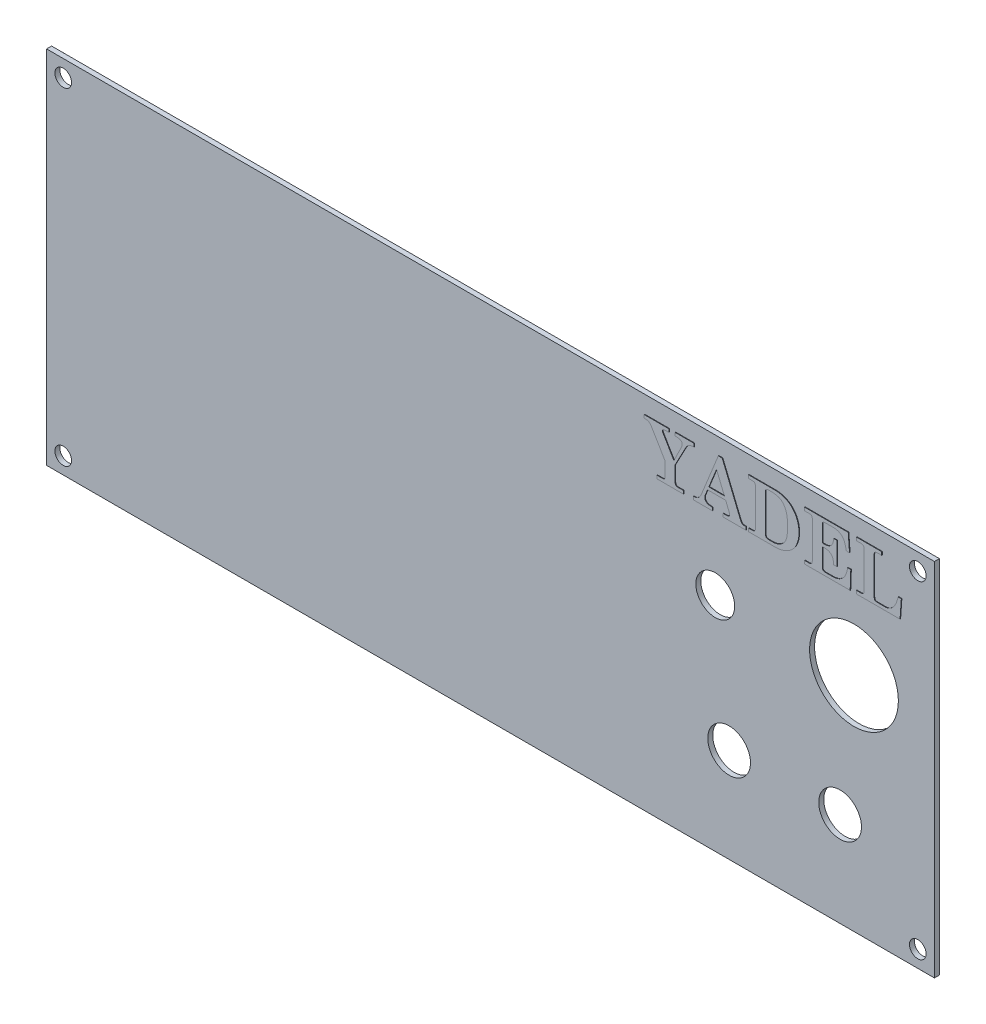
from build123d import *

# Parameters (mm, degrees)
ESQUISSE1_W             = 160
ESQUISSE1_H             = 65
ESQUISSE1_R             = 1.5
BOSS_EXTRU_1_DEPTH      = 0.9
ESQUISSE2_R             = 3.85
ESQUISSE2_R_2           = 3.5
ESQUISSE2_R_3           = 8
ENL_V_MAT_EXTRU_1_DEPTH = 0.9
BOSS_EXTRU_2_DEPTH      = 0.1


with BuildPart() as part:
    # Esquisse1 → Boss.-Extru.1 (new body)
    with BuildSketch(Plane.XY):
        with Locations((80, 32.5)):
            Rectangle(ESQUISSE1_W, ESQUISSE1_H)
        with Locations((3, 62)):
            Circle(ESQUISSE1_R, mode=Mode.SUBTRACT)
        with Locations((3, 3)):
            Circle(ESQUISSE1_R, mode=Mode.SUBTRACT)
        with Locations((157, 3)):
            Circle(ESQUISSE1_R, mode=Mode.SUBTRACT)
        with Locations((157, 62)):
            Circle(ESQUISSE1_R, mode=Mode.SUBTRACT)
    extrude(amount=BOSS_EXTRU_1_DEPTH)

    # Esquisse2 → Enlèv. mat.-Extru.1 (cut)
    with BuildSketch(Plane.XY.offset(0.9)):
        with Locations((123, 17)):
            Circle(ESQUISSE2_R)
        with Locations((143, 17)):
            Circle(ESQUISSE2_R)
        with Locations((120.5, 40)):
            Circle(ESQUISSE2_R_2)
        with Locations((145.5, 40)):
            Circle(ESQUISSE2_R_3)
    extrude(amount=-ENL_V_MAT_EXTRU_1_DEPTH, mode=Mode.SUBTRACT)

    # Esquisse3 → Boss.-Extru.2 (add)
    # profile 1 of 5: a face of its own
    with BuildSketch(Plane.XY.offset(0.9)):
        with BuildLine():
            Line((107.803249783, 61.878700087), (112.242599826, 61.878700087))
            Line((112.242599826, 61.878700087), (112.242599826, 61.309552645))
            Line((112.242599826, 61.309552645), (111.65033077, 61.309552645))
            add(Edge.make_bspline(
                [(111.65033077, 61.309552645), (111.601702611, 61.308454076), (111.512497697, 61.306438828), (111.389695329, 61.294195269), (111.290815636, 61.267793), (111.213442358, 61.233011403), (111.157163614, 61.187912023), (111.116336773, 61.137443039), (111.091860734, 61.078577306), (111.089493142, 61.037052927), (111.088297672, 61.016085996)],
                knots=[0, 0, 0, 0, 1.649978988, 3.026769637, 4.173115814, 5.108527378, 5.881060813, 6.597094959, 7.291630266, 8, 8, 8, 8], degree=3))
            add(Edge.make_bspline(
                [(111.088297672, 61.016085996), (111.089977515, 60.990502541), (111.093534977, 60.936323583), (111.113788996, 60.852925912), (111.148752249, 60.764295708), (111.180131697, 60.705704348), (111.196791403, 60.674597531)],
                knots=[0, 0, 0, 0, 0.848893184, 1.797730134, 2.830789942, 4, 4, 4, 4], degree=3))
            Line((111.196791403, 60.674597531), (113.151457147, 57.384213885))
            Line((113.151457147, 57.384213885), (114.467610605, 60.062764031))
            add(Edge.make_bspline(
                [(114.467610605, 60.062764031), (114.492308376, 60.116308185), (114.539555902, 60.21873965), (114.592060605, 60.37270507), (114.624057984, 60.519726034), (114.628901276, 60.615763261), (114.631240495, 60.662147431)],
                knots=[0, 0, 0, 0, 1.129148263, 2.160092213, 3.111359234, 4, 4, 4, 4], degree=3))
            add(Edge.make_bspline(
                [(114.631240495, 60.662147431), (114.628890225, 60.709960902), (114.624339537, 60.802539302), (114.577744453, 60.933247792), (114.500488055, 61.046231285), (114.394335627, 61.141897185), (114.259129041, 61.219788045), (114.093304867, 61.273166228), (113.897871595, 61.30454599), (113.758086441, 61.307806939), (113.683254288, 61.309552645)],
                knots=[0, 0, 0, 0, 0.884200254, 1.7120247, 2.535601234, 3.399669589, 4.34091696, 5.408595814, 6.612725681, 8, 8, 8, 8], degree=3))
            Line((113.683254288, 61.309552645), (113.380894709, 61.309552645))
            Line((113.380894709, 61.309552645), (113.380894709, 61.878700087))
            Line((113.380894709, 61.878700087), (116.795779358, 61.878700087))
            Line((116.795779358, 61.878700087), (116.795779358, 61.309552645))
            add(Edge.make_bspline(
                [(116.795779358, 61.309552645), (116.701864753, 61.305341496), (116.522933112, 61.297318167), (116.269410451, 61.249598245), (116.04271407, 61.181142313), (115.843132279, 61.078738008), (115.667196786, 60.944949669), (115.50647049, 60.77975143), (115.361006002, 60.579660238), (115.279838525, 60.429026345), (115.237738237, 60.350894924)],
                knots=[0, 0, 0, 0, 1.158631572, 2.207493144, 3.17456629, 4.071024185, 4.959115416, 5.890271789, 6.905717302, 8, 8, 8, 8], degree=3))
            Line((115.237738237, 60.350894924), (113.380894709, 56.838188058))
            Line((113.380894709, 56.838188058), (113.380894709, 54.054701352))
            add(Edge.make_bspline(
                [(113.380894709, 54.054701352), (113.382450672, 54.016000693), (113.385361202, 53.943608619), (113.410841916, 53.841847127), (113.452890241, 53.755385318), (113.513981536, 53.684544285), (113.594580242, 53.631287025), (113.69389748, 53.595560179), (113.8113998, 53.571852385), (113.895956035, 53.570089604), (113.941149222, 53.569147441)],
                knots=[0, 0, 0, 0, 1.088641102, 2.036373277, 2.932535239, 3.772977452, 4.639074189, 5.622189685, 6.729120018, 8, 8, 8, 8], degree=3))
            Line((113.941149222, 53.569147441), (114.860678057, 53.569147441))
            Line((114.860678057, 53.569147441), (114.860678057, 53))
            Line((114.860678057, 53), (110.079839549, 53))
            Line((110.079839549, 53), (110.079839549, 53.569147441))
            Line((110.079839549, 53.569147441), (110.994032627, 53.569147441))
            add(Edge.make_bspline(
                [(110.994032627, 53.569147441), (111.042106523, 53.570407346), (111.131696362, 53.572755286), (111.255430941, 53.592110108), (111.35552508, 53.62969708), (111.436075692, 53.68037011), (111.492597003, 53.752026332), (111.531736013, 53.838730773), (111.557208899, 53.94122924), (111.558786931, 54.015406048), (111.559622897, 54.054701352)],
                knots=[0, 0, 0, 0, 1.33431287, 2.486606761, 3.455237023, 4.285744345, 5.09261012, 5.946421484, 6.912112891, 8, 8, 8, 8], degree=3))
            Line((111.559622897, 54.054701352), (111.559622897, 56.528714137))
            Line((111.559622897, 56.528714137), (109.124738999, 60.626575716))
            add(Edge.make_bspline(
                [(109.124738999, 60.626575716), (109.087572878, 60.687978254), (109.016957941, 60.804641934), (108.895744566, 60.955835012), (108.773093192, 61.078123095), (108.642460107, 61.169434934), (108.500782074, 61.231277161), (108.347833512, 61.279040524), (108.177611233, 61.304739401), (108.058850731, 61.307906366), (107.99711563, 61.309552645)],
                knots=[0, 0, 0, 0, 1.231026377, 2.338927208, 3.317810476, 4.195831411, 5.056695332, 5.961387997, 6.940271265, 8, 8, 8, 8], degree=3))
            Line((107.99711563, 61.309552645), (107.803249783, 61.309552645))
            Line((107.803249783, 61.309552645), (107.803249783, 61.878700087))
        make_face()
    # profile 2 of 5: a face of its own
    with BuildSketch(Plane.XY.offset(0.9)):
        with BuildLine():
            Line((121.859413001, 62.106359063), (125.140903719, 54.134737711))
            add(Edge.make_bspline(
                [(125.140903719, 54.134737711), (125.162535864, 54.083929074), (125.202785299, 53.989392963), (125.272202564, 53.863025172), (125.344303077, 53.762426456), (125.42126125, 53.684604499), (125.508914365, 53.631091386), (125.606720225, 53.596891276), (125.715335168, 53.571871939), (125.792295276, 53.570086513), (125.832773577, 53.569147441)],
                knots=[0, 0, 0, 0, 1.370087271, 2.549226437, 3.57052343, 4.434214329, 5.246883247, 6.094249163, 6.997642324, 8, 8, 8, 8], degree=3))
            Line((125.832773577, 53.569147441), (126.129797398, 53.569147441))
            Line((126.129797398, 53.569147441), (126.129797398, 53))
            Line((126.129797398, 53), (122.03193582, 53))
            Line((122.03193582, 53), (122.03193582, 53.569147441))
            Line((122.03193582, 53.569147441), (122.416110343, 53.569147441))
            add(Edge.make_bspline(
                [(122.416110343, 53.569147441), (122.48608359, 53.570657513), (122.613848884, 53.573414776), (122.788842894, 53.589010359), (122.928078404, 53.620160562), (123.037351269, 53.661354147), (123.114383296, 53.719874955), (123.172272171, 53.781730339), (123.207211497, 53.855311027), (123.210994025, 53.9073202), (123.212916761, 53.933757521)],
                knots=[0, 0, 0, 0, 1.734001692, 3.166141951, 4.34179556, 5.263658256, 6.030315746, 6.716978054, 7.34781383, 8, 8, 8, 8], degree=3))
            add(Edge.make_bspline(
                [(123.212916761, 53.933757521), (123.209041763, 53.981061112), (123.200550254, 54.084720225), (123.162473963, 54.181644478), (123.14177333, 54.234338514)],
                knots=[0, 0, 0, 0, 0.912675961, 2, 2, 2, 2], degree=3))
            Line((123.14177333, 54.234338514), (122.48013943, 55.845737207))
            Line((122.48013943, 55.845737207), (119.219991742, 55.845737207))
            Line((119.219991742, 55.845737207), (118.921189335, 55.111181291))
            add(Edge.make_bspline(
                [(118.921189335, 55.111181291), (118.89119412, 55.039792722), (118.835985996, 54.908397465), (118.773210428, 54.722663571), (118.731754445, 54.566344834), (118.724976238, 54.470473829), (118.72198773, 54.428204361)],
                knots=[0, 0, 0, 0, 1.298659012, 2.390265557, 3.29026905, 4, 4, 4, 4], degree=3))
            add(Edge.make_bspline(
                [(118.72198773, 54.428204361), (118.725054075, 54.367274683), (118.731053374, 54.248065854), (118.788640404, 54.079236901), (118.882025026, 53.92864631), (119.012600607, 53.800652641), (119.172685927, 53.6948607), (119.363594012, 53.623044711), (119.578086465, 53.575182324), (119.730749158, 53.57121796), (119.810482212, 53.569147441)],
                knots=[0, 0, 0, 0, 0.936681703, 1.832616438, 2.715165993, 3.645764122, 4.629294347, 5.650980637, 6.773148287, 8, 8, 8, 8], degree=3))
            Line((119.810482212, 53.569147441), (120.096834519, 53.569147441))
            Line((120.096834519, 53.569147441), (120.096834519, 53))
            Line((120.096834519, 53), (116.68194987, 53))
            Line((116.68194987, 53), (116.68194987, 53.569147441))
            Line((116.68194987, 53.569147441), (116.886487232, 53.569147441))
            add(Edge.make_bspline(
                [(116.886487232, 53.569147441), (116.94245459, 53.571393839), (117.052139405, 53.575796329), (117.210689924, 53.61484444), (117.359549915, 53.676555233), (117.447114546, 53.737607236), (117.491206388, 53.768349046)],
                knots=[0, 0, 0, 0, 1.034931053, 2.028257604, 3.007159006, 4, 4, 4, 4], degree=3))
            add(Edge.make_bspline(
                [(117.491206388, 53.768349046), (117.550618664, 53.817331564), (117.669365499, 53.915232526), (117.824637524, 54.088261488), (117.959252194, 54.280679111), (118.030007987, 54.421312909), (118.065689587, 54.492233448)],
                knots=[0, 0, 0, 0, 0.989267864, 1.977241644, 2.979938569, 4, 4, 4, 4], degree=3))
            Line((118.065689587, 54.492233448), (121.153314457, 62.106359063))
            Line((121.153314457, 62.106359063), (121.859413001, 62.106359063))
        make_face()
        Polygon((120.836726192, 59.835105055), (119.449429304, 56.414884649), (122.24536611, 56.414884649), align=None, mode=Mode.SUBTRACT)
    # profile 3 of 5: a face of its own
    with BuildSketch(Plane.XY.offset(0.9)):
        with BuildLine():
            Line((126.585115351, 61.878700087), (131.33216073, 61.878700087))
            add(Edge.make_bspline(
                [(131.33216073, 61.878700087), (131.438321406, 61.87681702), (131.647970502, 61.873098287), (131.957649382, 61.848867085), (132.256807448, 61.803695047), (132.545937995, 61.742945439), (132.826063483, 61.667894174), (133.094949566, 61.570136838), (133.355389279, 61.459057376), (133.604603323, 61.328544147), (133.841808453, 61.182935297), (134.068647699, 61.024527887), (134.278792715, 60.847322999), (134.479953208, 60.659308332), (134.663866586, 60.453965853), (134.836922412, 60.235656328), (134.993405232, 60.000678235), (135.140426317, 59.754147061), (135.268513023, 59.494704027), (135.384271337, 59.227922476), (135.476999571, 58.951184082), (135.556615149, 58.667762558), (135.616040134, 58.375137674), (135.661490976, 58.074915097), (135.685839128, 57.766423441), (135.689583509, 57.558552944), (135.691474415, 57.453578729)],
                knots=[0, 0, 0, 0, 1.095124878, 2.162683496, 3.201422963, 4.213739968, 5.209254947, 6.189989335, 7.162451537, 8.128043583, 9.088801183, 10.032215269, 10.978894355, 11.921971404, 12.870209753, 13.819610945, 14.793226264, 15.780195082, 16.778467595, 17.775821777, 18.777628539, 19.786559333, 20.810849883, 21.85563876, 22.91710156, 24, 24, 24, 24], degree=3))
            add(Edge.make_bspline(
                [(135.691474415, 57.453578729), (135.690499242, 57.345025691), (135.688578151, 57.131175962), (135.661659508, 56.815514135), (135.624008542, 56.510127864), (135.568549285, 56.215549819), (135.497542022, 55.932157937), (135.41038442, 55.659392169), (135.30700111, 55.397379189), (135.188327209, 55.146158012), (135.051867904, 54.907596451), (134.903705115, 54.679059197), (134.736309935, 54.465015503), (134.555833155, 54.261576653), (134.356327981, 54.072976845), (134.143721076, 53.894194511), (133.912536075, 53.731516272), (133.670620392, 53.578470502), (133.417922425, 53.442632354), (133.158760297, 53.324669441), (132.894978697, 53.224804938), (132.625832894, 53.142759915), (132.351860883, 53.078963291), (132.07338285, 53.032083076), (131.790386823, 53.00521641), (131.600189063, 53.001743753), (131.504683548, 53)],
                knots=[0, 0, 0, 0, 1.13887174, 2.243579878, 3.322457727, 4.367025756, 5.387125682, 6.38669751, 7.369928061, 8.341215495, 9.299704588, 10.252278776, 11.196874661, 12.148635726, 13.103584326, 14.075469414, 15.061295075, 16.067717662, 17.078228411, 18.069458256, 19.054006876, 20.036134399, 21.020132398, 22.004130398, 22.997798122, 24, 24, 24, 24], degree=3))
            Line((131.504683548, 53), (126.585115351, 53))
            Line((126.585115351, 53), (126.585115351, 53.569147441))
            Line((126.585115351, 53.569147441), (127.305442582, 53.569147441))
            add(Edge.make_bspline(
                [(127.305442582, 53.569147441), (127.346560569, 53.570476021), (127.425160603, 53.573015698), (127.534219825, 53.602278963), (127.629073624, 53.646549124), (127.705723592, 53.712873909), (127.763912204, 53.796087175), (127.808213822, 53.892827569), (127.83220402, 54.004947778), (127.835506684, 54.084238035), (127.837239722, 54.125844783)],
                knots=[0, 0, 0, 0, 1.122856504, 2.146422164, 3.068293037, 3.966132366, 4.88499783, 5.829313612, 6.860954614, 8, 8, 8, 8], degree=3))
            Line((127.837239722, 54.125844783), (127.837239722, 60.795541362))
            add(Edge.make_bspline(
                [(127.837239722, 60.795541362), (127.835733265, 60.837199959), (127.832878367, 60.916147497), (127.806700897, 61.025078826), (127.76321462, 61.117336954), (127.69895409, 61.19111937), (127.611784666, 61.24619875), (127.503146024, 61.284189187), (127.370984442, 61.306776423), (127.275306715, 61.308579005), (127.223627637, 61.309552645)],
                knots=[0, 0, 0, 0, 1.078064526, 2.043048672, 2.881216632, 3.697706621, 4.541346901, 5.523059816, 6.66211301, 8, 8, 8, 8], degree=3))
            Line((127.223627637, 61.309552645), (126.585115351, 61.309552645))
            Line((126.585115351, 61.309552645), (126.585115351, 61.878700087))
        make_face()
        with BuildLine():
            add(Edge.make_bspline(
                [(130.87150702, 53.569147441), (130.942103536, 53.570597949), (131.081196281, 53.57345581), (131.2867536, 53.593606596), (131.486337708, 53.625608918), (131.680486025, 53.669314213), (131.867481591, 53.728584941), (132.048111305, 53.800041593), (132.222720683, 53.884032263), (132.39163419, 53.979224818), (132.550693079, 54.088072693), (132.701248422, 54.204785112), (132.837438618, 54.333399004), (132.963617642, 54.469479161), (133.077686916, 54.615956106), (133.180194656, 54.771968219), (133.272185694, 54.936786065), (133.351182933, 55.114367518), (133.421060519, 55.308612053), (133.481756543, 55.524821318), (133.529917416, 55.766515236), (133.573050965, 56.031542197), (133.604012795, 56.321920845), (133.627452789, 56.636272789), (133.638675609, 56.975652517), (133.641226541, 57.209907123), (133.642543625, 57.330856312)],
                knots=[0, 0, 0, 0, 0.949765025, 1.871273987, 2.776130108, 3.66816782, 4.546113786, 5.412643397, 6.279613467, 7.151267918, 8.018531503, 8.870659598, 9.711550513, 10.535742305, 11.365473911, 12.206175636, 13.045248569, 13.902142185, 14.818075952, 15.820638119, 16.9204126, 18.132138158, 19.432318017, 20.847999306, 22.372574464, 24, 24, 24, 24], degree=3))
            add(Edge.make_bspline(
                [(133.642543625, 57.330856312), (133.641605549, 57.458935017), (133.639785073, 57.707490608), (133.623323244, 58.068710253), (133.598152545, 58.407104721), (133.557798248, 58.721867622), (133.512181276, 59.013959785), (133.450035759, 59.28172003), (133.38289792, 59.528088898), (133.299907286, 59.751492448), (133.208521725, 59.955323638), (133.110799823, 60.143576216), (133.003728371, 60.316117872), (132.890343836, 60.47475776), (132.769290753, 60.618482976), (132.63843432, 60.744753644), (132.501748146, 60.857680777), (132.355059039, 60.955220184), (132.195682267, 61.040287115), (132.01986428, 61.11268233), (131.826442846, 61.171866601), (131.617289724, 61.224702329), (131.390047413, 61.262895425), (131.145243668, 61.288168032), (130.883664312, 61.307411531), (130.703173229, 61.308823954), (130.610054914, 61.309552645)],
                knots=[0, 0, 0, 0, 1.586297713, 3.07844435, 4.478005486, 5.787764439, 7.008271247, 8.137702286, 9.190763021, 10.168851427, 11.085936446, 11.956353167, 12.7939037, 13.598887414, 14.369895025, 15.117682938, 15.848254541, 16.563120313, 17.29571888, 18.082579543, 18.914023681, 19.799183864, 20.752903796, 21.764942868, 22.846897305, 24, 24, 24, 24], degree=3))
            add(Edge.make_bspline(
                [(130.610054914, 61.309552645), (130.559653367, 61.309311796), (130.464154932, 61.308855445), (130.327803952, 61.302785109), (130.206737426, 61.296552579), (130.099710787, 61.286501886), (130.008381638, 61.2704324), (129.931288048, 61.252504611), (129.867530733, 61.234603918), (129.804709566, 61.201857994), (129.742755818, 61.148202173), (129.691590338, 61.062457977), (129.664420065, 60.955422028), (129.660580073, 60.878100568), (129.658511535, 60.836448835)],
                knots=[0, 0, 0, 0, 1.479388087, 2.803073613, 4.005921637, 5.038015802, 5.956445119, 6.724759669, 7.363251975, 7.892554548, 8.792999824, 9.730199517, 10.777297743, 12, 12, 12, 12], degree=3))
            Line((129.658511535, 60.836448835), (129.658511535, 54.132959126))
            add(Edge.make_bspline(
                [(129.658511535, 54.132959126), (129.660286774, 54.086042649), (129.663570601, 53.999256793), (129.685367013, 53.878298377), (129.726337517, 53.779038407), (129.782570602, 53.697842053), (129.860428709, 53.638323542), (129.95614171, 53.598983755), (130.069843102, 53.573403707), (130.151611432, 53.57063722), (130.195644433, 53.569147441)],
                knots=[0, 0, 0, 0, 1.25011308, 2.312452742, 3.253936465, 4.091094141, 4.912462066, 5.824887263, 6.828681705, 8, 8, 8, 8], degree=3))
            Line((130.195644433, 53.569147441), (130.87150702, 53.569147441))
        make_face(mode=Mode.SUBTRACT)
    # profile 4 of 5: a face of its own
    with BuildSketch(Plane.XY.offset(0.9)):
        with BuildLine():
            Line((136.715939809, 61.878700087), (144.570174501, 61.878700087))
            Line((144.570174501, 61.878700087), (144.797833478, 58.805303903))
            Line((144.797833478, 58.805303903), (144.228686037, 58.805303903))
            add(Edge.make_bspline(
                [(144.228686037, 58.805303903), (144.212588181, 58.892551357), (144.181508387, 59.060998189), (144.128422817, 59.303109826), (144.070592467, 59.525709853), (144.01401275, 59.73084529), (143.948413154, 59.914871174), (143.885947364, 60.08243173), (143.816442696, 60.229318553), (143.722792545, 60.399156863), (143.59085712, 60.586037357), (143.409396962, 60.781239268), (143.203197532, 60.94495168), (142.973863208, 61.081529396), (142.71257191, 61.184713903), (142.418000851, 61.258714845), (142.087406374, 61.302734743), (141.855008005, 61.307209683), (141.733330223, 61.309552645)],
                knots=[0, 0, 0, 0, 1.072076736, 2.069836117, 2.994244358, 3.851381349, 4.639837713, 5.354288182, 6.011291753, 6.60137414, 7.696564963, 8.766053296, 9.811074081, 10.867743878, 11.979932002, 13.192784047, 14.530214239, 16, 16, 16, 16], degree=3))
            Line((141.733330223, 61.309552645), (140.463419994, 61.309552645))
            add(Edge.make_bspline(
                [(140.463419994, 61.309552645), (140.417106415, 61.308219846), (140.331116005, 61.305745238), (140.212194902, 61.287311673), (140.113182328, 61.254113714), (140.034857805, 61.205577245), (139.974877382, 61.144437829), (139.934124998, 61.071830171), (139.907759335, 60.988796864), (139.904748402, 60.929744572), (139.903165481, 60.898699336)],
                knots=[0, 0, 0, 0, 1.405644672, 2.609860082, 3.640124863, 4.553926833, 5.381221799, 6.211643069, 7.059816985, 8, 8, 8, 8], degree=3))
            Line((139.903165481, 60.898699336), (139.903165481, 57.894667997))
            Line((139.903165481, 57.894667997), (140.330026063, 57.894667997))
            add(Edge.make_bspline(
                [(140.330026063, 57.894667997), (140.3899389, 57.896279236), (140.505882918, 57.899397325), (140.675092395, 57.916468623), (140.833844464, 57.949028959), (140.983064857, 57.992594837), (141.121398282, 58.049931035), (141.248796623, 58.120045014), (141.366676554, 58.201817293), (141.474549271, 58.296898199), (141.571715903, 58.406532649), (141.657044595, 58.532672852), (141.733238307, 58.673243312), (141.799799494, 58.828934147), (141.851977218, 59.001133707), (141.895826239, 59.187736448), (141.932784331, 59.389371669), (141.945517133, 59.529635113), (141.952096271, 59.602110321)],
                knots=[0, 0, 0, 0, 1.081249572, 2.09244671, 3.06376056, 4.001264571, 4.893234814, 5.759762344, 6.620327001, 7.476692944, 8.348158368, 9.256085728, 10.218226265, 11.229536556, 12.305428516, 13.460016981, 14.687571108, 16, 16, 16, 16], degree=3))
            Line((141.952096271, 59.602110321), (142.521243712, 59.602110321))
            Line((142.521243712, 59.602110321), (142.521243712, 55.504248742))
            Line((142.521243712, 55.504248742), (141.952096271, 55.504248742))
            add(Edge.make_bspline(
                [(141.952096271, 55.504248742), (141.946506981, 55.584968338), (141.935750061, 55.740317995), (141.90528339, 55.96301937), (141.865246934, 56.167825643), (141.811581638, 56.353560567), (141.750666791, 56.522503951), (141.675554372, 56.671920794), (141.587893854, 56.801914935), (141.49111291, 56.916543473), (141.380344937, 57.013991278), (141.257147632, 57.096784997), (141.122640673, 57.16974142), (140.973046308, 57.225340942), (140.812174769, 57.271971065), (140.637622411, 57.303908615), (140.450713, 57.320736592), (140.321758001, 57.323893989), (140.255325461, 57.325520555)],
                knots=[0, 0, 0, 0, 1.36267904, 2.622556782, 3.784025089, 4.874631183, 5.876381068, 6.805394682, 7.683463336, 8.512150666, 9.325776323, 10.159563316, 11.008465503, 11.896867056, 12.842059005, 13.827344498, 14.880733395, 16, 16, 16, 16], degree=3))
            Line((140.255325461, 57.325520555), (139.903165481, 57.325520555))
            Line((139.903165481, 57.325520555), (139.903165481, 54.012015294))
            add(Edge.make_bspline(
                [(139.903165481, 54.012015294), (139.904955544, 53.978080811), (139.90830136, 53.914653667), (139.930580715, 53.826483061), (139.971966265, 53.753301462), (140.012873137, 53.719281585), (140.033002242, 53.702541373)],
                knots=[0, 0, 0, 0, 1.167205204, 2.181630186, 3.105232066, 4, 4, 4, 4], degree=3))
            add(Edge.make_bspline(
                [(140.033002242, 53.702541373), (140.06907346, 53.681441255), (140.144942725, 53.637060985), (140.280607956, 53.598746537), (140.435190999, 53.573849064), (140.545703006, 53.570769805), (140.603928269, 53.569147441)],
                knots=[0, 0, 0, 0, 0.841207128, 1.769326616, 2.82472911, 4, 4, 4, 4], degree=3))
            Line((140.603928269, 53.569147441), (141.708430022, 53.569147441))
            add(Edge.make_bspline(
                [(141.708430022, 53.569147441), (141.801018773, 53.571071008), (141.982030033, 53.574831585), (142.24738686, 53.608018709), (142.500060278, 53.660320296), (142.739132504, 53.735770764), (142.965892063, 53.829656205), (143.177535935, 53.948532102), (143.3788204, 54.085737625), (143.565528431, 54.24612186), (143.737130033, 54.428643388), (143.892094549, 54.632799452), (144.031783647, 54.857173653), (144.150145663, 55.104934688), (144.253739256, 55.37308431), (144.339959071, 55.662753002), (144.410384191, 55.974051292), (144.440724321, 56.189916441), (144.456345013, 56.30105516)],
                knots=[0, 0, 0, 0, 1.031571464, 2.016725019, 2.975737277, 3.90365013, 4.806884149, 5.706048434, 6.604143789, 7.517950739, 8.443507882, 9.391092695, 10.370289309, 11.38394948, 12.446627214, 13.571304651, 14.749580046, 16, 16, 16, 16], degree=3))
            Line((144.456345013, 56.30105516), (145.025492455, 56.30105516))
            Line((145.025492455, 56.30105516), (144.911662966, 53))
            Line((144.911662966, 53), (136.715939809, 53))
            Line((136.715939809, 53), (136.715939809, 53.569147441))
            Line((136.715939809, 53.569147441), (137.523417742, 53.569147441))
            add(Edge.make_bspline(
                [(137.523417742, 53.569147441), (137.566203134, 53.570909981), (137.647825752, 53.574272415), (137.762395887, 53.597721319), (137.860579328, 53.641814955), (137.941511247, 53.702594461), (138.005089126, 53.778955786), (138.050181578, 53.868335401), (138.077269829, 53.969546614), (138.080316665, 54.040894301), (138.081893669, 54.077822967)],
                knots=[0, 0, 0, 0, 1.197590393, 2.284669081, 3.25007612, 4.18594059, 5.093121875, 6.005900763, 6.967879297, 8, 8, 8, 8], degree=3))
            Line((138.081893669, 54.077822967), (138.081893669, 60.889806407))
            add(Edge.make_bspline(
                [(138.081893669, 60.889806407), (138.080377897, 60.923775496), (138.07750462, 60.988166876), (138.050976092, 61.077839875), (138.004258823, 61.152096631), (137.93935673, 61.214100281), (137.848448937, 61.258555355), (137.732190269, 61.289694017), (137.587841276, 61.305110027), (137.482535473, 61.307993514), (137.425595525, 61.309552645)],
                knots=[0, 0, 0, 0, 0.911783951, 1.72836626, 2.480019639, 3.246558688, 4.108965725, 5.168374927, 6.468910761, 8, 8, 8, 8], degree=3))
            Line((137.425595525, 61.309552645), (136.715939809, 61.309552645))
            Line((136.715939809, 61.309552645), (136.715939809, 61.878700087))
        make_face()
    # profile 5 of 5: a face of its own
    with BuildSketch(Plane.XY.offset(0.9)):
        with BuildLine():
            Line((146.049957849, 61.309552645), (146.049957849, 61.878700087))
            Line((146.049957849, 61.878700087), (150.603137381, 61.878700087))
            Line((150.603137381, 61.878700087), (150.603137381, 61.309552645))
            Line((150.603137381, 61.309552645), (149.833009749, 61.309552645))
            add(Edge.make_bspline(
                [(149.833009749, 61.309552645), (149.781864979, 61.308854159), (149.687146487, 61.307560585), (149.557297822, 61.281744227), (149.4499292, 61.245214442), (149.366002164, 61.187682764), (149.3074262, 61.110136592), (149.265847698, 61.015941041), (149.241842765, 60.902234754), (149.238806875, 60.819967125), (149.237183521, 60.775976919)],
                knots=[0, 0, 0, 0, 1.317174052, 2.439364582, 3.40274332, 4.226216974, 5.021934816, 5.877883306, 6.86526021, 8, 8, 8, 8], degree=3))
            Line((149.237183521, 60.775976919), (149.237183521, 54.191652456))
            add(Edge.make_bspline(
                [(149.237183521, 54.191652456), (149.237829724, 54.13106144), (149.239002536, 54.021093116), (149.263694472, 53.873669923), (149.299905132, 53.759605677), (149.359251947, 53.671945142), (149.459276706, 53.622700639), (149.590577478, 53.592836766), (149.763644227, 53.571754638), (149.892823807, 53.570078874), (149.964625095, 53.569147441)],
                knots=[0, 0, 0, 0, 1.253318516, 2.274682744, 3.08242206, 3.723352428, 4.399534733, 5.325689848, 6.513550565, 8, 8, 8, 8], degree=3))
            Line((149.964625095, 53.569147441), (151.257656939, 53.569147441))
            add(Edge.make_bspline(
                [(151.257656939, 53.569147441), (151.317673579, 53.571280521), (151.437274391, 53.575531309), (151.61430279, 53.607372225), (151.788840919, 53.656108051), (151.957683626, 53.731788461), (152.126313471, 53.821630238), (152.289778394, 53.935121779), (152.450788448, 54.067942073), (152.608876717, 54.22038074), (152.761218914, 54.395674312), (152.903318682, 54.596228668), (153.036636922, 54.821285118), (153.160483827, 55.070740155), (153.275679019, 55.34355106), (153.383226665, 55.640005111), (153.477818966, 55.961979086), (153.533859222, 56.185833539), (153.562704077, 56.30105516)],
                knots=[0, 0, 0, 0, 0.746952398, 1.488522408, 2.233867827, 2.997739128, 3.787258218, 4.610437708, 5.470623944, 6.384302497, 7.342016262, 8.35813022, 9.440650158, 10.596202486, 11.823439516, 13.126538548, 14.520981459, 16, 16, 16, 16], degree=3))
            Line((153.562704077, 56.30105516), (154.131851518, 56.30105516))
            Line((154.131851518, 56.30105516), (153.904192541, 53))
            Line((153.904192541, 53), (146.049957849, 53))
            Line((146.049957849, 53), (146.049957849, 53.569147441))
            Line((146.049957849, 53.569147441), (146.868107296, 53.569147441))
            add(Edge.make_bspline(
                [(146.868107296, 53.569147441), (146.910309639, 53.570872766), (146.990777842, 53.574162484), (147.103270577, 53.59800551), (147.199215657, 53.640189043), (147.279775951, 53.697052447), (147.340437675, 53.772481154), (147.386953842, 53.859474986), (147.410870884, 53.962180233), (147.414173007, 54.034439687), (147.415911709, 54.07248721)],
                knots=[0, 0, 0, 0, 1.195528741, 2.279542841, 3.234602015, 4.14844858, 5.043106676, 5.952155301, 6.921726988, 8, 8, 8, 8], degree=3))
            Line((147.415911709, 54.07248721), (147.415911709, 60.841784592))
            add(Edge.make_bspline(
                [(147.415911709, 60.841784592), (147.414415825, 60.879896036), (147.411591513, 60.951852577), (147.385194154, 61.051806792), (147.339699032, 61.135339279), (147.274098746, 61.202451288), (147.186705832, 61.253679574), (147.074407509, 61.285196568), (146.938881675, 61.306500214), (146.839756249, 61.308483142), (146.786292352, 61.309552645)],
                knots=[0, 0, 0, 0, 1.00990991, 1.906766507, 2.716615905, 3.506507968, 4.367174043, 5.37229384, 6.582730811, 8, 8, 8, 8], degree=3))
            Line((146.786292352, 61.309552645), (146.049957849, 61.309552645))
        make_face()
    extrude(amount=BOSS_EXTRU_2_DEPTH)


solid = part.part
